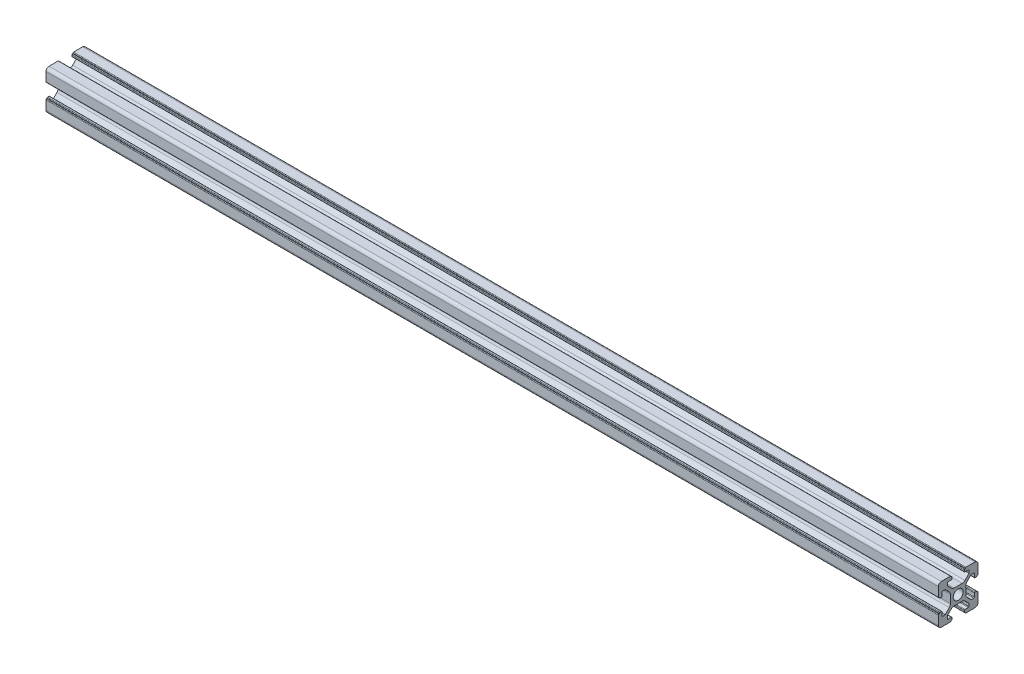
from build123d import *

# Parameters (mm, degrees)
SKETCH_11_R            = 2.5
MEMBER_20_2020_1_DEPTH = 450


with BuildPart() as part:
    # 草图11 → Member 20 2020_1 (new body)
    with BuildSketch(Plane(origin=(-186.258278146, 66.30794702, 0), x_dir=(0, 1, 0), z_dir=(1, 0, 0))):
        with BuildLine():
            Line((3.9, 0), (3.9, -2.010912703))
            ThreePointArc((3.9, -2.010912703), (4.052240935, -2.776279568), (4.485786438, -3.425126266))
            Line((4.485786438, -3.425126266), (6.560660172, -5.5))
            Line((6.560660172, -5.5), (7.9, -5.5))
            ThreePointArc((7.9, -5.5), (8.112132034, -5.412132034), (8.2, -5.2))
            Line((8.2, -5.2), (8.2, -3.4))
            ThreePointArc((8.2, -3.4), (8.287867966, -3.187867966), (8.5, -3.1))
            Line((8.5, -3.1), (9.2, -3.1))
            ThreePointArc((9.2, -3.1), (9.412132034, -3.187867966), (9.5, -3.4))
            Line((9.5, -3.4), (9.5, -3.6))
            Line((9.5, -3.6), (9.7, -3.6))
            ThreePointArc((9.7, -3.6), (9.912132034, -3.687867966), (10, -3.9))
            Line((10, -3.9), (10, -8.5))
            ThreePointArc((10, -8.5), (9.560660172, -9.560660172), (8.5, -10))
            Line((8.5, -10), (3.9, -10))
            ThreePointArc((3.9, -10), (3.687867966, -9.912132034), (3.6, -9.7))
            ThreePointArc((3.6, -9.7), (3.541421356, -9.558578644), (3.4, -9.5))
            ThreePointArc((3.4, -9.5), (3.187867966, -9.412132034), (3.1, -9.2))
            Line((3.1, -9.2), (3.1, -8.5))
            ThreePointArc((3.1, -8.5), (3.187867966, -8.287867966), (3.4, -8.2))
            Line((3.4, -8.2), (5.2, -8.2))
            ThreePointArc((5.2, -8.2), (5.412132034, -8.112132034), (5.5, -7.9))
            Line((5.5, -7.9), (5.5, -6.68492424))
            ThreePointArc((5.5, -6.68492424), (5.47716386, -6.570119211), (5.412132034, -6.472792206))
            Line((5.412132034, -6.472792206), (3.425126266, -4.485786438))
            ThreePointArc((3.425126266, -4.485786438), (2.776279568, -4.052240935), (2.010912703, -3.9))
            Line((2.010912703, -3.9), (0, -3.9))
            Line((0, -3.9), (-2.010912703, -3.9))
            ThreePointArc((-2.010912703, -3.9), (-2.776279568, -4.052240935), (-3.425126266, -4.485786438))
            Line((-3.425126266, -4.485786438), (-5.412132034, -6.472792206))
            ThreePointArc((-5.412132034, -6.472792206), (-5.47716386, -6.570119211), (-5.5, -6.68492424))
            Line((-5.5, -6.68492424), (-5.5, -7.9))
            ThreePointArc((-5.5, -7.9), (-5.412132034, -8.112132034), (-5.2, -8.2))
            Line((-5.2, -8.2), (-3.4, -8.2))
            ThreePointArc((-3.4, -8.2), (-3.187867966, -8.287867966), (-3.1, -8.5))
            Line((-3.1, -8.5), (-3.1, -9.2))
            ThreePointArc((-3.1, -9.2), (-3.187867966, -9.412132034), (-3.4, -9.5))
            ThreePointArc((-3.4, -9.5), (-3.541421356, -9.558578644), (-3.6, -9.7))
            ThreePointArc((-3.6, -9.7), (-3.687867966, -9.912132034), (-3.9, -10))
            Line((-3.9, -10), (-8.5, -10))
            ThreePointArc((-8.5, -10), (-9.560660172, -9.560660172), (-10, -8.5))
            Line((-10, -8.5), (-10, -3.9))
            ThreePointArc((-10, -3.9), (-9.912132034, -3.687867966), (-9.7, -3.6))
            Line((-9.7, -3.6), (-9.5, -3.6))
            Line((-9.5, -3.6), (-9.5, -3.4))
            ThreePointArc((-9.5, -3.4), (-9.412132034, -3.187867966), (-9.2, -3.1))
            Line((-9.2, -3.1), (-8.5, -3.1))
            ThreePointArc((-8.5, -3.1), (-8.287867965, -3.187867966), (-8.2, -3.4))
            Line((-8.2, -3.4), (-8.2, -5.2))
            ThreePointArc((-8.2, -5.2), (-8.112132034, -5.412132034), (-7.9, -5.5))
            Line((-7.9, -5.5), (-6.68492424, -5.5))
            ThreePointArc((-6.68492424, -5.5), (-6.570119211, -5.47716386), (-6.472792206, -5.412132034))
            Line((-6.472792206, -5.412132034), (-4.485786438, -3.425126266))
            ThreePointArc((-4.485786438, -3.425126266), (-4.052240935, -2.776279568), (-3.9, -2.010912703))
            Line((-3.9, -2.010912703), (-3.9, 0))
            Line((-3.9, 0), (-3.9, 2.010912703))
            ThreePointArc((-3.9, 2.010912703), (-4.052240935, 2.776279568), (-4.485786438, 3.425126266))
            Line((-4.485786438, 3.425126266), (-6.472792206, 5.412132034))
            ThreePointArc((-6.472792206, 5.412132034), (-6.570119211, 5.47716386), (-6.68492424, 5.5))
            Line((-6.68492424, 5.5), (-7.9, 5.5))
            ThreePointArc((-7.9, 5.5), (-8.112132034, 5.412132034), (-8.2, 5.2))
            Line((-8.2, 5.2), (-8.2, 3.4))
            ThreePointArc((-8.2, 3.4), (-8.287867965, 3.187867966), (-8.5, 3.1))
            Line((-8.5, 3.1), (-9.2, 3.1))
            ThreePointArc((-9.2, 3.1), (-9.412132034, 3.187867966), (-9.5, 3.4))
            Line((-9.5, 3.4), (-9.5, 3.6))
            Line((-9.5, 3.6), (-9.7, 3.6))
            ThreePointArc((-9.7, 3.6), (-9.912132034, 3.687867966), (-10, 3.9))
            Line((-10, 3.9), (-10, 8.5))
            ThreePointArc((-10, 8.5), (-9.560660172, 9.560660172), (-8.5, 10))
            Line((-8.5, 10), (-3.9, 10))
            ThreePointArc((-3.9, 10), (-3.687867966, 9.912132034), (-3.6, 9.7))
            Line((-3.6, 9.7), (-3.6, 9.5))
            Line((-3.6, 9.5), (-3.4, 9.5))
            ThreePointArc((-3.4, 9.5), (-3.187867966, 9.412132034), (-3.1, 9.2))
            Line((-3.1, 9.2), (-3.1, 8.5))
            ThreePointArc((-3.1, 8.5), (-3.187867966, 8.287867966), (-3.4, 8.2))
            Line((-3.4, 8.2), (-5.2, 8.2))
            ThreePointArc((-5.2, 8.2), (-5.412132034, 8.112132034), (-5.5, 7.9))
            Line((-5.5, 7.9), (-5.5, 6.68492424))
            ThreePointArc((-5.5, 6.68492424), (-5.47716386, 6.570119211), (-5.412132034, 6.472792206))
            Line((-5.412132034, 6.472792206), (-3.425126266, 4.485786438))
            ThreePointArc((-3.425126266, 4.485786438), (-2.776279568, 4.052240935), (-2.010912703, 3.9))
            Line((-2.010912703, 3.9), (0, 3.9))
            Line((0, 3.9), (2.010912703, 3.9))
            ThreePointArc((2.010912703, 3.9), (2.776279568, 4.052240935), (3.425126266, 4.485786438))
            Line((3.425126266, 4.485786438), (5.412132034, 6.472792206))
            ThreePointArc((5.412132034, 6.472792206), (5.47716386, 6.570119211), (5.5, 6.68492424))
            Line((5.5, 6.68492424), (5.5, 7.9))
            ThreePointArc((5.5, 7.9), (5.412132034, 8.112132034), (5.2, 8.2))
            Line((5.2, 8.2), (3.4, 8.2))
            ThreePointArc((3.4, 8.2), (3.187867966, 8.287867966), (3.1, 8.5))
            Line((3.1, 8.5), (3.1, 9.2))
            ThreePointArc((3.1, 9.2), (3.187867966, 9.412132034), (3.4, 9.5))
            Line((3.4, 9.5), (3.6, 9.5))
            Line((3.6, 9.5), (3.6, 9.7))
            ThreePointArc((3.6, 9.7), (3.687867966, 9.912132034), (3.9, 10))
            Line((3.9, 10), (8.5, 10))
            ThreePointArc((8.5, 10), (9.560660172, 9.560660172), (10, 8.5))
            Line((10, 8.5), (10, 3.9))
            ThreePointArc((10, 3.9), (9.912132034, 3.687867966), (9.7, 3.6))
            Line((9.7, 3.6), (9.5, 3.6))
            Line((9.5, 3.6), (9.5, 3.4))
            ThreePointArc((9.5, 3.4), (9.412132034, 3.187867966), (9.2, 3.1))
            Line((9.2, 3.1), (8.5, 3.1))
            ThreePointArc((8.5, 3.1), (8.287867966, 3.187867966), (8.2, 3.4))
            Line((8.2, 3.4), (8.2, 5.2))
            ThreePointArc((8.2, 5.2), (8.112132034, 5.412132034), (7.9, 5.5))
            Line((7.9, 5.5), (6.68492424, 5.5))
            ThreePointArc((6.68492424, 5.5), (6.570119211, 5.47716386), (6.472792206, 5.412132034))
            Line((6.472792206, 5.412132034), (4.485786438, 3.425126266))
            ThreePointArc((4.485786438, 3.425126266), (4.052240935, 2.776279568), (3.9, 2.010912703))
            Line((3.9, 2.010912703), (3.9, 0))
        make_face()
        Circle(SKETCH_11_R, mode=Mode.SUBTRACT)
    extrude(amount=MEMBER_20_2020_1_DEPTH)


solid = part.part
